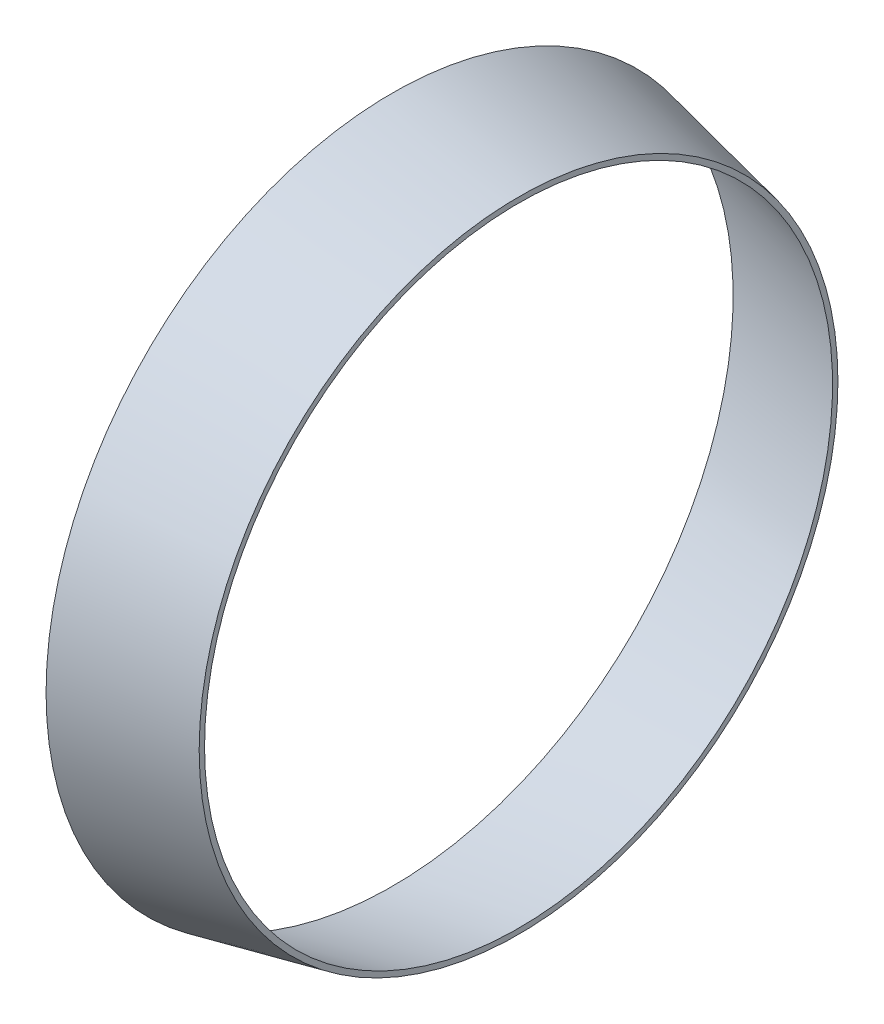
from build123d import *


with BuildPart() as part:
    # Sketch2 → Revolve1 (revolve)
    with BuildSketch(Plane.XY, mode=Mode.PRIVATE) as revolve1_sk:
        Polygon((0, 64.5), (0, 63.5), (23.523150547, 58.5), (23.523150547, 59.5), align=None)
    revolve(revolve1_sk.sketch.rotate(Axis((0, 0, 0), (1, 0, 0)), 90), axis=Axis((0, 0, 0), (1, 0, 0)))


solid = part.part
